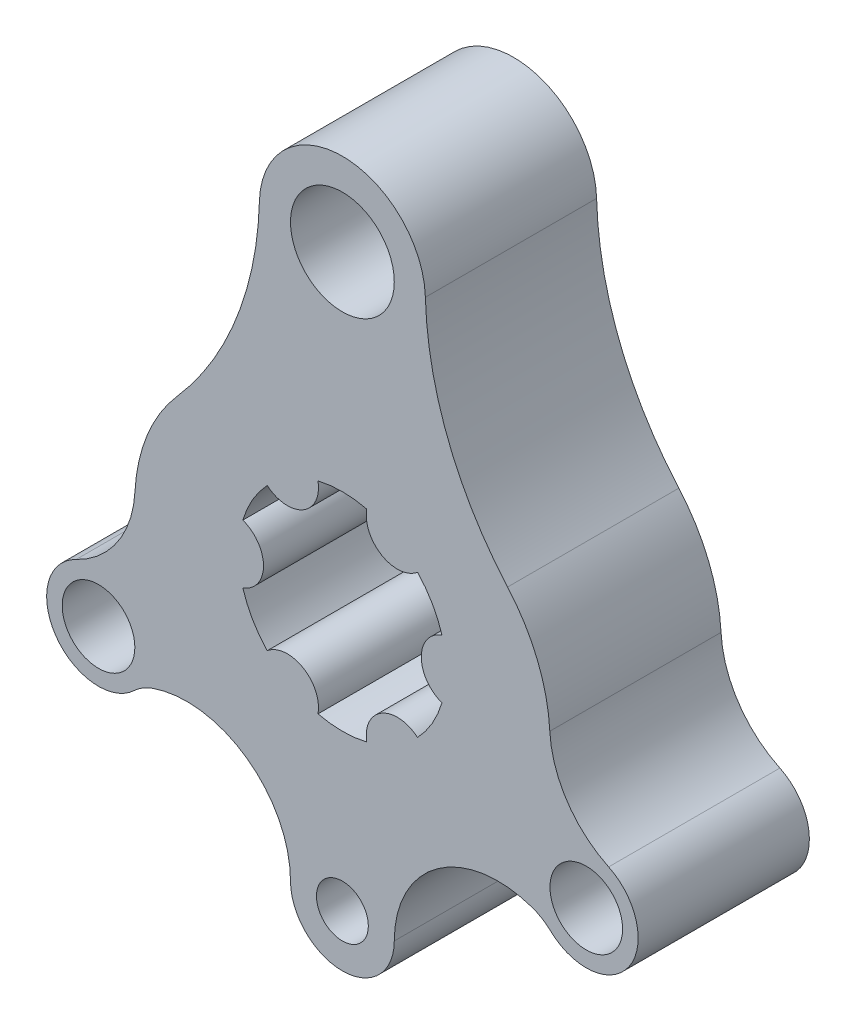
from build123d import *

# Parameters (mm, degrees)
SKETCH1_R           = 7
SKETCH1_R_2         = 5
SKETCH1_R_3         = 10
BOSS_EXTRUDE1_DEPTH = 33


with BuildPart() as part:
    # Sketch1 → Boss-Extrude1 (new body)
    with BuildSketch(Plane.XY):
        with BuildLine():
            ThreePointArc((15.994033369, 60.436917155), (0, 76), (-15.994033369, 60.436917155))
            ThreePointArc((-15.994033369, 60.436917155), (-20.382321677, 38.833168081), (-31.840542672, 20))
            ThreePointArc((-31.840542672, 20), (-37.590888328, 10.684300366), (-39.97719521, 0))
            ThreePointArc((-39.97719521, 0), (-43.316807871, -10.045731282), (-51.316335778, -16.979509689))
            ThreePointArc((-51.316335778, -16.979509689), (-55.247302477, -31.655263199), (-40.141001052, -33.276959078))
            ThreePointArc((-40.141001052, -33.276959078), (-38.467197276, -32.003260227), (-36.564004207, -31.107836313))
            ThreePointArc((-36.564004207, -31.107836313), (-18.40862571, -33.701532524), (-10, -50))
            ThreePointArc((-10, -50), (0, -60), (10, -50))
            ThreePointArc((10, -50), (18.40862571, -33.701532524), (36.564004207, -31.107836313))
            ThreePointArc((36.564004207, -31.107836313), (38.467197276, -32.003260227), (40.141001052, -33.276959078))
            ThreePointArc((40.141001052, -33.276959078), (55.247302477, -31.655263199), (51.316335778, -16.979509689))
            ThreePointArc((51.316335778, -16.979509689), (43.316807871, -10.045731282), (39.97719521, 0))
            ThreePointArc((39.97719521, 0), (37.590888328, 10.684300366), (31.840542672, 20))
            ThreePointArc((31.840542672, 20), (20.382321677, 38.833168081), (15.994033369, 60.436917155))
        make_face()
        with Locations((-47, -26)):
            Circle(SKETCH1_R, mode=Mode.SUBTRACT)
        with Locations((0, -50)):
            Circle(SKETCH1_R_2, mode=Mode.SUBTRACT)
        with BuildLine():
            ThreePointArc((-14.486315543, 13.789367716), (-7.601024573, 13.16536075), (-4.698784972, 19.440201125))
            ThreePointArc((-4.698784972, 19.440201125), (0, 20), (4.698784972, 19.440201125))
            ThreePointArc((4.698784972, 19.440201125), (7.601024573, 13.16536075), (14.486315543, 13.789367716))
            ThreePointArc((14.486315543, 13.789367716), (17.320508076, 10), (19.185100515, 5.65083341))
            ThreePointArc((19.185100515, 5.65083341), (15.202049146, 0), (19.185100515, -5.65083341))
            ThreePointArc((19.185100515, -5.65083341), (17.320508076, -10), (14.486315543, -13.789367716))
            ThreePointArc((14.486315543, -13.789367716), (7.601024573, -13.16536075), (4.698784972, -19.440201125))
            ThreePointArc((4.698784972, -19.440201125), (0, -20), (-4.698784972, -19.440201125))
            ThreePointArc((-4.698784972, -19.440201125), (-7.601024573, -13.16536075), (-14.486315543, -13.789367716))
            ThreePointArc((-14.486315543, -13.789367716), (-17.320508076, -10), (-19.185100515, -5.65083341))
            ThreePointArc((-19.185100515, -5.65083341), (-15.202049146, 0), (-19.185100515, 5.65083341))
            ThreePointArc((-19.185100515, 5.65083341), (-17.320508076, 10), (-14.486315543, 13.789367716))
        make_face(mode=Mode.SUBTRACT)
        with Locations((47, -26)):
            Circle(SKETCH1_R, mode=Mode.SUBTRACT)
        with Locations((0, 60)):
            Circle(SKETCH1_R_3, mode=Mode.SUBTRACT)
    extrude(amount=BOSS_EXTRUDE1_DEPTH)


solid = part.part
